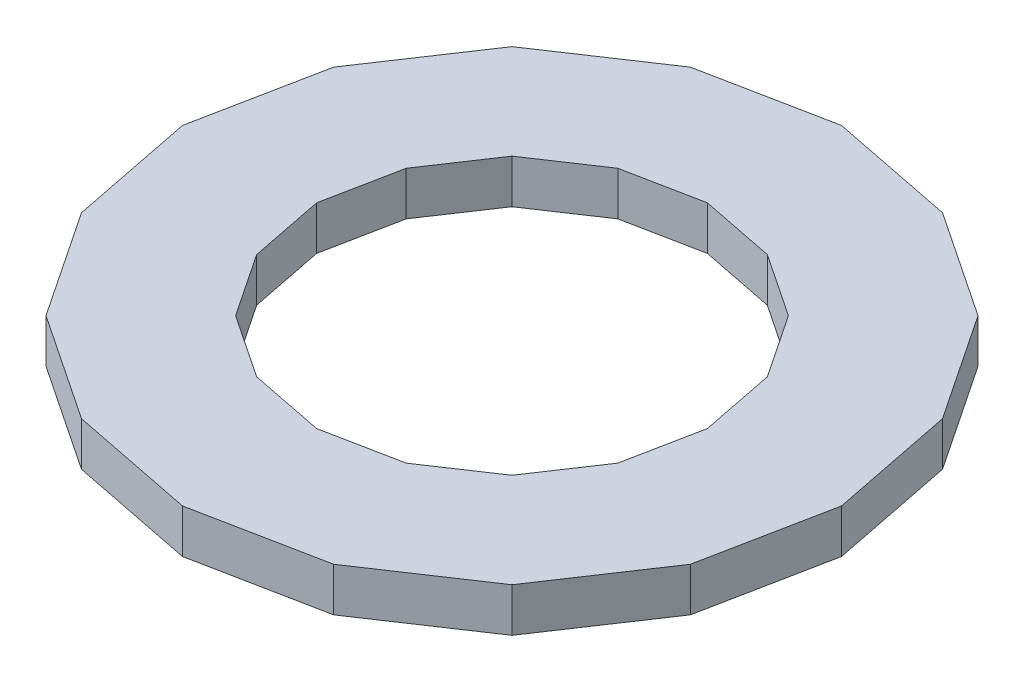
from build123d import *

# Parameters (mm, degrees)
BOSS_EXTRUDE1_DEPTH = 19.05


with BuildPart() as part:
    # Sketch1 → Boss-Extrude1 (new body)
    with BuildSketch(Plane(origin=(0, 0, 0), x_dir=(1, 0, 0), z_dir=(0, 1, 0))):
        Polygon((143.21571522, 0), (132.314068026, 54.806281469), (101.268803404, 101.268803404), (54.806281469, 132.314068026), (0, 143.21571522), (-54.806281469, 132.314068026), (-101.268803404, 101.268803404), (-132.314068026, 54.806281469), (-143.21571522, 0), (-132.314068026, -54.806281469), (-101.268803404, -101.268803404), (-54.806281469, -132.314068026), (0, -143.21571522), (54.806281469, -132.314068026), (101.268803404, -101.268803404), (132.314068026, -54.806281469), align=None)
        Polygon((84.946080528, 0), (78.479945167, 32.507457662), (60.065949577, 60.065949577), (32.507457662, 78.479945167), (0, 84.946080528), (-32.507457662, 78.479945167), (-60.065949577, 60.065949577), (-78.479945167, 32.507457662), (-84.946080528, 0), (-78.479945167, -32.507457662), (-60.065949577, -60.065949577), (-32.507457662, -78.479945167), (0, -84.946080528), (32.507457662, -78.479945167), (60.065949577, -60.065949577), (78.479945167, -32.507457662), align=None, mode=Mode.SUBTRACT)
    extrude(amount=BOSS_EXTRUDE1_DEPTH)


solid = part.part
